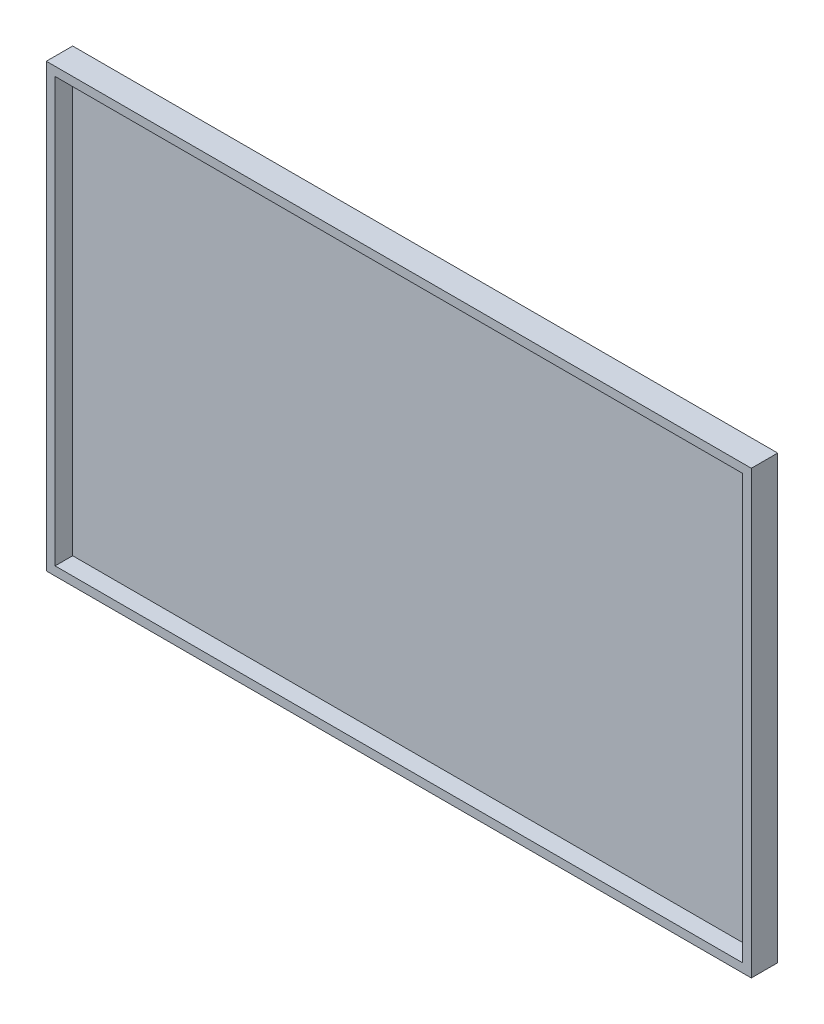
from build123d import *

# Parameters (mm, degrees)
ESQUISSE1_W        = 160.5
ESQUISSE1_H        = 100.5
BOSS_EXTRU_1_DEPTH = 2
ESQUISSE2_W        = 160.5
ESQUISSE2_H        = 100.5
ESQUISSE2_W_2      = 156.5
ESQUISSE2_H_2      = 96.5
BOSS_EXTRU_2_DEPTH = 4


with BuildPart() as part:
    # Esquisse1 → Boss.-Extru.1 (new body)
    with BuildSketch(Plane.XY):
        with Locations((29.111896839, -20.03202995)):
            Rectangle(ESQUISSE1_W, ESQUISSE1_H)
    extrude(amount=BOSS_EXTRU_1_DEPTH)

    # Esquisse2 → Boss.-Extru.2 (add)
    with BuildSketch(Plane.XY.offset(2)):
        with Locations((29.111896839, -20.03202995)):
            Rectangle(ESQUISSE2_W, ESQUISSE2_H)
        with Locations((29.111896839, -20.03202995)):
            Rectangle(ESQUISSE2_W_2, ESQUISSE2_H_2, mode=Mode.SUBTRACT)
    extrude(amount=BOSS_EXTRU_2_DEPTH)


solid = part.part
